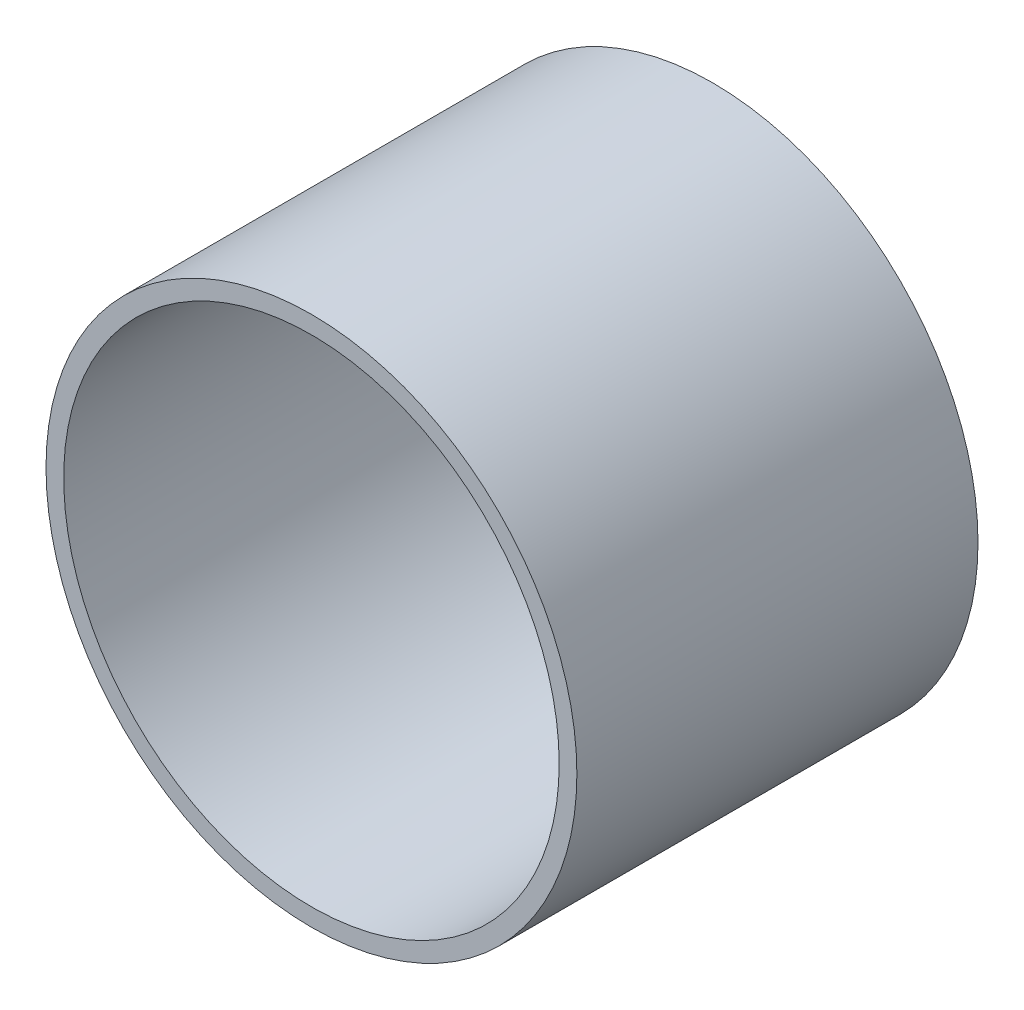
from build123d import *

# Parameters (mm, degrees)
SKETCH_1_W = 68
SKETCH_1_H = 3


with BuildPart() as part:
    # 草图1 → 旋转1 (revolve)
    with BuildSketch(Plane(origin=(0, 0, 0), x_dir=(0, 0, -1), z_dir=(1, 0, 0)), mode=Mode.PRIVATE) as revolve_1_sk:
        with Locations((171, 43.5)):
            Rectangle(SKETCH_1_W, SKETCH_1_H)
    revolve(revolve_1_sk.sketch.rotate(Axis((0, 0, -132), (0, 0, -1)), 90), axis=Axis((0, 0, -132), (0, 0, -1)))


solid = part.part
